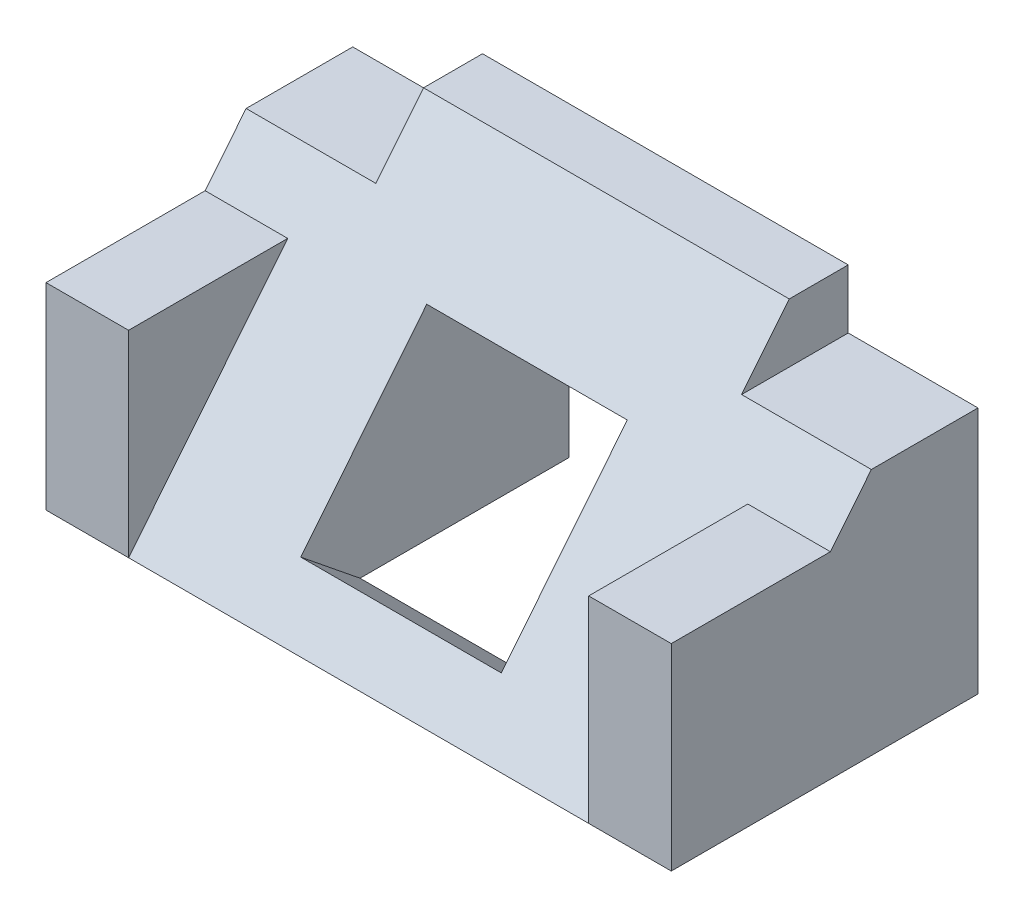
from build123d import *

# Parameters (mm, degrees)
BOSS_EXTRUDE1_DEPTH     = 1346.2
CUT_EXTRUDE1_DEPTH      = 279.4
CUT_EXTRUDE2_DEPTH      = 1441.932396055
CUT_EXTRUDE2_DEPTH_BACK = 279.4
SKETCH5_W               = 660.4
SKETCH5_H               = 424.18
BOSS_EXTRUDE2_DEPTH     = 177.8
SKETCH6_W               = 660.4
SKETCH6_H               = 424.18
BOSS_EXTRUDE3_DEPTH     = 177.8
SKETCH7_W               = 431.8
SKETCH7_H               = 431.8
CUT_EXTRUDE3_DEPTH      = 660.4


with BuildPart() as part:
    # Sketch1 → Boss-Extrude1 (new body)
    with BuildSketch(Plane(origin=(0, 0, 0), x_dir=(0, 0, -1), z_dir=(1, 0, 0))):
        Polygon((100.623076923, 266.7), (-330.2, -266.7), (330.2, -266.7), (330.2, 266.7), (203.2, 266.7), align=None)
        Polygon((203.2, 393.7), (100.623076923, 266.7), (203.2, 266.7), (330.2, 266.7), (330.2, 393.7), align=None)
    extrude(amount=BOSS_EXTRUDE1_DEPTH)

    # Sketch2 → Cut-Extrude1 (cut)
    with BuildSketch(Plane(origin=(1346.2, 0, 0), x_dir=(0, 0, -1), z_dir=(1, 0, 0))):
        Polygon((330.2, 393.7), (330.2, 266.7), (100.623076923, 266.7), (203.2, 393.7), align=None)
    extrude(amount=-CUT_EXTRUDE1_DEPTH, mode=Mode.SUBTRACT)

    # Sketch3 → Cut-Extrude2 (cut, two sides: drawn at the far end of the back side and taken through both)
    with BuildSketch(Plane.ZY.offset(-CUT_EXTRUDE2_DEPTH_BACK)):
        Polygon((-330.2, 2271.593273182), (-330.2, 393.7), (-330.2, 266.7), (-100.623076923, 266.7), (1777.270196259, 266.7), (4365.963516587, 2987.839370769), (2258.493320327, 4992.732643951), align=None)
    extrude(amount=CUT_EXTRUDE2_DEPTH + CUT_EXTRUDE2_DEPTH_BACK, mode=Mode.SUBTRACT)

    # Sketch5 → Boss-Extrude2 (add)
    with BuildSketch(Plane(origin=(1346.2, 0, 0), x_dir=(0, 0, -1), z_dir=(1, 0, 0))):
        with Locations((0, -54.61)):
            Rectangle(SKETCH5_W, SKETCH5_H)
    extrude(amount=-BOSS_EXTRUDE2_DEPTH)

    # Sketch6 → Boss-Extrude3 (add)
    with BuildSketch(Plane.ZY):
        with Locations((0, -54.61)):
            Rectangle(SKETCH6_W, SKETCH6_H)
    extrude(amount=-BOSS_EXTRUDE3_DEPTH)

    # Sketch7 → Cut-Extrude3 (cut)
    with BuildSketch(Plane(origin=(0, 56.109668756, 69.469113697), x_dir=(1, 0, 0), z_dir=(0, 0.6283371070876211, 0.7779411802037217))):
        with Locations((681.021503016, -66.438627043)):
            Rectangle(SKETCH7_W, SKETCH7_H)
    extrude(amount=-CUT_EXTRUDE3_DEPTH, mode=Mode.SUBTRACT)


solid = part.part
